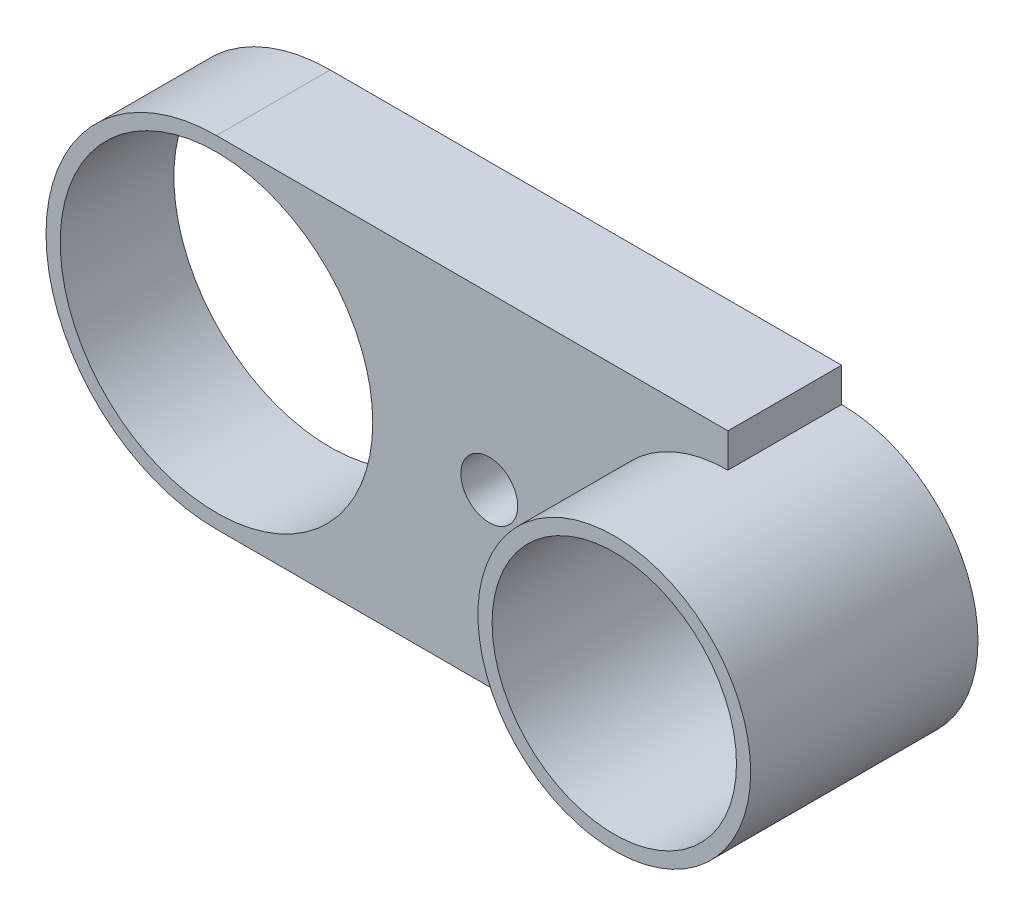
from build123d import *
from build123d.topology import SkipClean

# Parameters (mm, degrees)
SKETCH1_R           = 30
BOSS_EXTRUDE1_DEPTH = 20
SKETCH2_R           = 27.5
CUT_EXTRUDE1_DEPTH  = 47.904157598
BOSS_EXTRUDE2_START = -20
BOSS_EXTRUDE2_DEPTH = 20
SKETCH6_R           = 21.5
CUT_EXTRUDE2_DEPTH  = 35
SKETCH10_R          = 5
CUT_EXTRUDE5_DEPTH  = 120.565881421
SKETCH11_R          = 24
BOSS_EXTRUDE3_DEPTH = 20
BOSS_EXTRUDE4_START = -40
SKETCH12_R          = 24
BOSS_EXTRUDE4_DEPTH = 40
SKETCH13_R          = 21.5
CUT_EXTRUDE6_DEPTH  = 35


with BuildPart() as part:
    # Sketch1 → Boss-Extrude1 (new body)
    with BuildSketch(Plane.XY):
        Circle(SKETCH1_R)
    extrude(amount=BOSS_EXTRUDE1_DEPTH)

    # Sketch2 → Cut-Extrude1 (cut, through all)
    with BuildSketch(Plane.XY.offset(20)):
        Circle(SKETCH2_R)
    extrude(amount=-CUT_EXTRUDE1_DEPTH, mode=Mode.SUBTRACT)

    # Sketch4 → Boss-Extrude2 (add)
    with BuildSketch(Plane.XY.offset(20).offset(BOSS_EXTRUDE2_START)):
        with BuildLine():
            Line((0, 30), (90, 30))
            Line((90, 30), (90, 24))
            ThreePointArc((90, 24), (114, 0), (90, -24))
            Line((90, -24), (90, -30))
            Line((90, -30), (0, -30))
            ThreePointArc((0, -30), (30, 0), (0, 30))
        make_face()
    extrude(amount=BOSS_EXTRUDE2_DEPTH)

    # Sketch6 → Cut-Extrude2 (cut)
    with BuildSketch(Plane.XY.offset(20)):
        with Locations((90, 0)):
            Circle(SKETCH6_R)
    extrude(amount=-CUT_EXTRUDE2_DEPTH, mode=Mode.SUBTRACT)

    # Sketch10 → Cut-Extrude5 (cut, through all)
    with BuildSketch(Plane.XY.offset(20)):
        with Locations((48, 0)):
            Circle(SKETCH10_R)
    extrude(amount=-CUT_EXTRUDE5_DEPTH, mode=Mode.SUBTRACT)

    # Sketch11 → Boss-Extrude3 (add)
    with BuildSketch(Plane.XY.offset(20)):
        with Locations((90, 0)):
            Circle(SKETCH11_R)
    extrude(amount=BOSS_EXTRUDE3_DEPTH)

    # Sketch12 → Boss-Extrude4 (add)
    with SkipClean():  # the faces are left unmerged after this step: merging them gives an invalid solid
        with BuildSketch(Plane.XY.offset(40).offset(BOSS_EXTRUDE4_START)):
            with Locations((90, 0)):
                Circle(SKETCH12_R)
        extrude(amount=BOSS_EXTRUDE4_DEPTH)

    # Sketch13 → Cut-Extrude6 (cut)
    with SkipClean():  # the faces are left unmerged after this step: merging them gives an invalid solid
        with BuildSketch(Plane.XY.offset(40)):
            with Locations((90, 0)):
                Circle(SKETCH13_R)
        extrude(amount=-CUT_EXTRUDE6_DEPTH, mode=Mode.SUBTRACT)


solid = part.part
